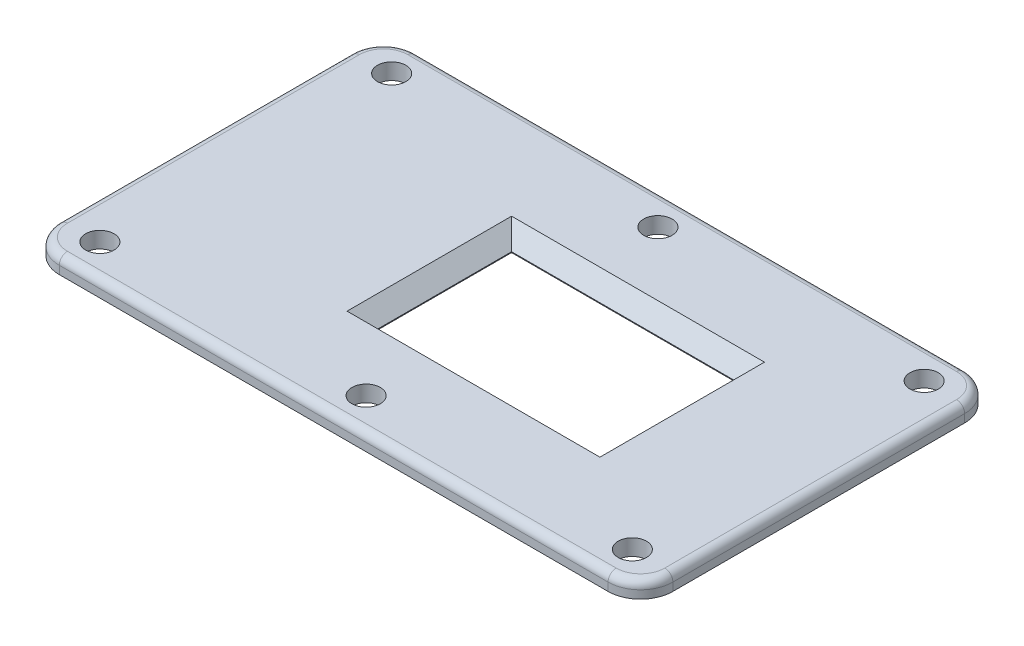
from build123d import *

# Parameters (mm, degrees)
SKETCH1_W           = 27.4
SKETCH1_H           = 16.5
SKETCH1_R           = 1.75
BOSS_EXTRUDE1_DEPTH = 2
SKETCH1_3_W         = 31.5
SKETCH1_3_H         = 20.5
SKETCH1_3_W_2       = 27.4
SKETCH1_3_H_2       = 16.5
BOSS_EXTRUDE2_DEPTH = 1
FILLET1_R           = 1
CHAMFER1_SIZE       = 1.9


with BuildPart() as part:
    # Sketch1 → Boss-Extrude1 (new body)
    with BuildSketch(Plane(origin=(0, 0, 0), x_dir=(1, 0, 0), z_dir=(0, 1, 0))):
        with BuildLine():
            Line((28.45, 22), (-39.25, 22))
            ThreePointArc((-39.25, 22), (-42.078427125, 20.828427125), (-43.25, 18))
            Line((-43.25, 18), (-43.25, -18))
            ThreePointArc((-43.25, -18), (-42.078427125, -20.828427125), (-39.25, -22))
            Line((-39.25, -22), (28.45, -22))
            ThreePointArc((28.45, -22), (31.278427125, -20.828427125), (32.45, -18))
            Line((32.45, -18), (32.45, 18))
            ThreePointArc((32.45, 18), (31.278427125, 20.828427125), (28.45, 22))
        make_face()
        Rectangle(SKETCH1_W, SKETCH1_H, mode=Mode.SUBTRACT)
        with Locations((-38.25, -18)):
            Circle(SKETCH1_R, mode=Mode.SUBTRACT)
        with Locations((-5.4, -18)):
            Circle(SKETCH1_R, mode=Mode.SUBTRACT)
        with Locations((27.45, -18)):
            Circle(SKETCH1_R, mode=Mode.SUBTRACT)
        with Locations((-38.25, 18)):
            Circle(SKETCH1_R, mode=Mode.SUBTRACT)
        with Locations((-5.4, 18)):
            Circle(SKETCH1_R, mode=Mode.SUBTRACT)
        with Locations((27.45, 18)):
            Circle(SKETCH1_R, mode=Mode.SUBTRACT)
    extrude(amount=BOSS_EXTRUDE1_DEPTH)

    # Sketch1<3> → Boss-Extrude2 (add)
    with BuildSketch(Plane(origin=(0, 0, 0), x_dir=(1, 0, 0), z_dir=(0, 1, 0))):
        Rectangle(SKETCH1_3_W, SKETCH1_3_H)
        Rectangle(SKETCH1_3_W_2, SKETCH1_3_H_2, mode=Mode.SUBTRACT)
    extrude(amount=BOSS_EXTRUDE2_DEPTH)

    # Fillet1
    fillet1_edges = [part.edges().sort_by_distance(p)[0] for p in [
        (-42.078427125, 2, 20.828427125),
        (-43.25, 2, 0),
        (-42.078427125, 2, -20.828427125),
        (-5.4, 2, -22),
        (31.278427125, 2, -20.828427125),
        (32.45, 2, 0),
        (31.278427125, 2, 20.828427125),
        (-5.4, 2, 22),
    ]]
    fillet(fillet1_edges, radius=FILLET1_R)

    # Chamfer1
    chamfer1_edges = [part.edges().sort_by_distance(p)[0] for p in [
        (-13.7, 2, 0),
        (0, 2, 8.25),
        (13.7, 2, 0),
        (0, 2, -8.25),
    ]]
    chamfer(chamfer1_edges, length=CHAMFER1_SIZE)


solid = part.part
